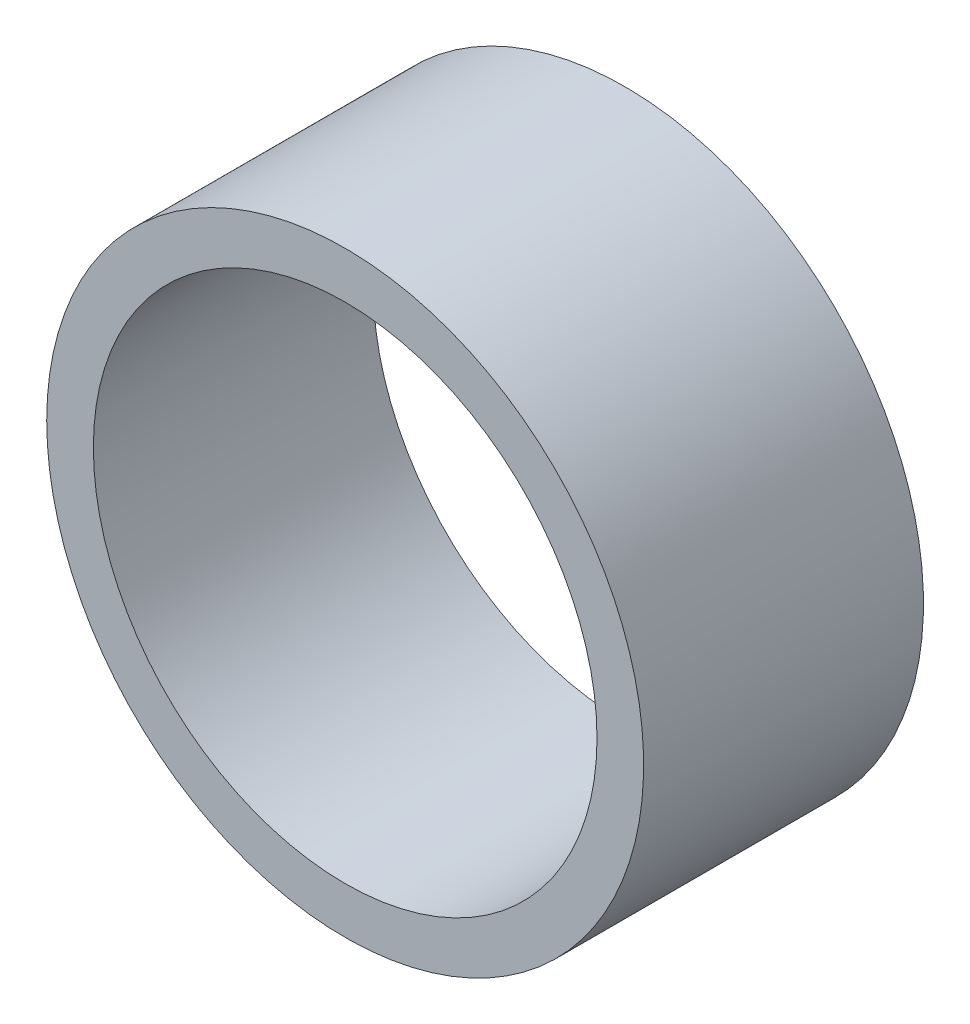
from build123d import *

# Parameters (mm, degrees)
SKETCH1_R           = 3.2
SKETCH1_R_2         = 2.7
BOSS_EXTRUDE1_DEPTH = 3


with BuildPart() as part:
    # Sketch1 → Boss-Extrude1 (new body)
    with BuildSketch(Plane.XY):
        with Locations(Location((0, 0, 0), (0, 0, 180))):
            Circle(SKETCH1_R)
        with Locations(Location((0, 0, 0), (0, 0, 180))):
            Circle(SKETCH1_R_2, mode=Mode.SUBTRACT)
    extrude(amount=BOSS_EXTRUDE1_DEPTH)


solid = part.part
